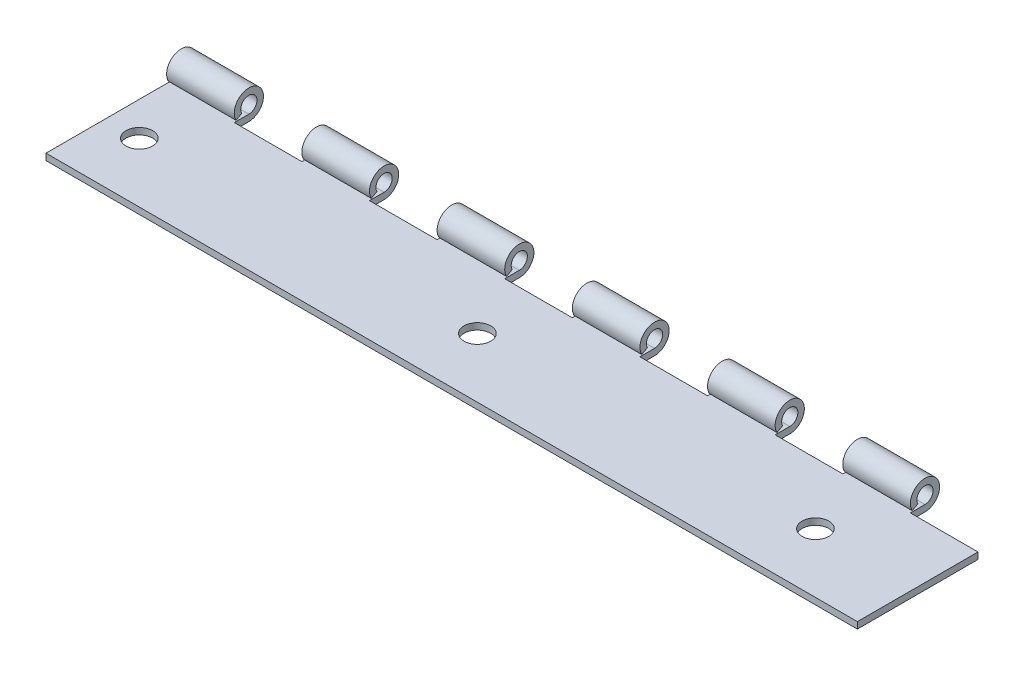
from build123d import *

# Parameters (mm, degrees)
BOSS_EXTRUDE1_DEPTH = 76.2
SKETCH4_W           = 12.7
SKETCH4_H           = 5.4864
CUT_EXTRUDE1_DEPTH  = 81.368682621
LPATTERN1_COUNT     = 6
LPATTERN1_PITCH     = 25.4
SKETCH5_R           = 2.5019
CUT_EXTRUDE2_DEPTH  = 81.435122899


with BuildPart() as part:
    # Sketch3 → Boss-Extrude1 (new, symmetric)
    with BuildSketch(Plane(origin=(0, 0, 0), x_dir=(0, 0, -1), z_dir=(1, 0, 0))):
        with BuildLine():
            Line((0, -2.7432), (-25.4, -2.7432))
            Line((-25.4, -2.7432), (-25.4, -1.524))
            Line((-25.4, -1.524), (0, -1.524))
            ThreePointArc((0, -1.524), (0.77286266, 1.313491267), (-1.332215689, -0.740119827))
            Line((-1.332215689, -0.740119827), (-2.39798824, -1.332215689))
            ThreePointArc((-2.39798824, -1.332215689), (1.391152789, 2.36428428), (0, -2.7432))
        make_face()
    extrude(amount=BOSS_EXTRUDE1_DEPTH, both=True)

    # Sketch4 → Cut-Extrude1 (cut, symmetric)
    with BuildSketch(Plane(origin=(0, 0, 0), x_dir=(1, 0, 0), z_dir=(0, 1, 0))):
        with Locations((-57.15, 0)):
            Rectangle(SKETCH4_W, SKETCH4_H)
    cut_extrude1 = extrude(amount=CUT_EXTRUDE1_DEPTH, both=True, mode=Mode.SUBTRACT)

    # LPattern1: Cut-Extrude1 ×6
    with Locations(*[(i * LPATTERN1_PITCH, 0, 0) for i in range(1, LPATTERN1_COUNT)]):
        add(cut_extrude1, mode=Mode.SUBTRACT)

    # Sketch5 → Cut-Extrude2 (cut, through all)
    with BuildSketch(Plane(origin=(0, -1.524, 0), x_dir=(1, 0, 0), z_dir=(0, 1, 0))):
        with Locations(Location((57.15, -14.224, 0), (0, 0, 270))):
            Circle(SKETCH5_R)
        with Locations(Location((-6.35, -14.224, 0), (0, 0, 270))):
            Circle(SKETCH5_R)
        with Locations(Location((-69.85, -14.224, 0), (0, 0, 270))):
            Circle(SKETCH5_R)
    extrude(amount=-CUT_EXTRUDE2_DEPTH, mode=Mode.SUBTRACT)


solid = part.part
